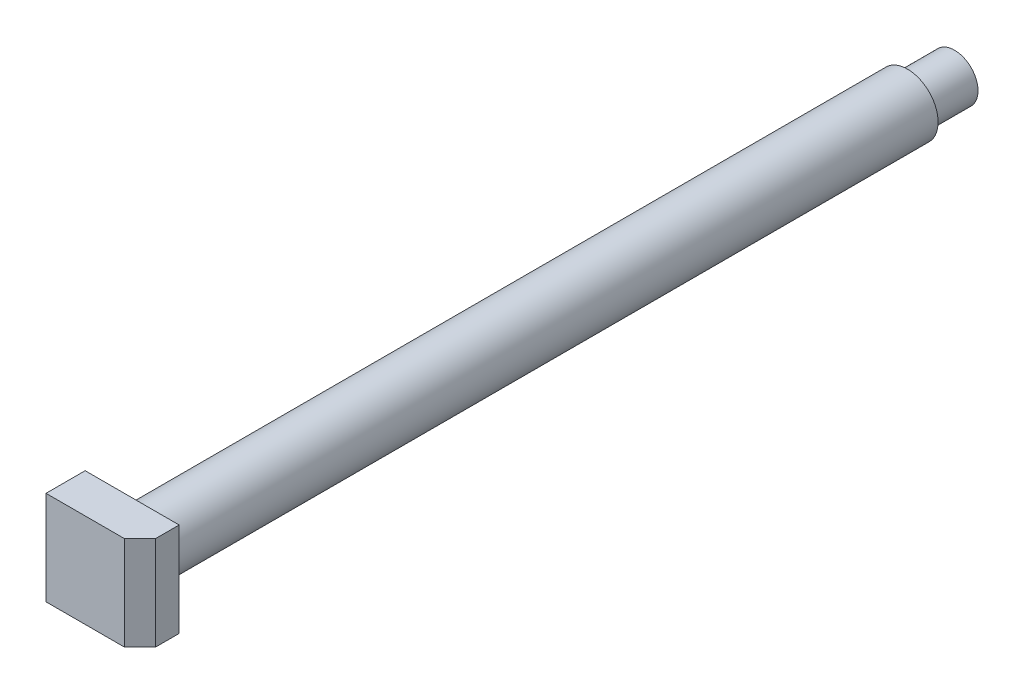
from build123d import *

# Parameters (mm, degrees)
ESQUISSE1_R                                   = 3.9
BOSS_EXTRU_1_DEPTH                            = 105
ESQUISSE2_W                                   = 12
ESQUISSE2_H                                   = 12
BOSS_EXTRU_2_DEPTH                            = 5
ESQUISSE14_R                                  = 3.9
ESQUISSE14_R_2                                = 3
ENL_V_MAT_EXTRU_1_DEPTH                       = 6
CHANFREIN1_SIZE                               = 2
TROU_POUR_TARAUDAGE_POUR_TROU_TARAUD_M3_D     = 2.5
TROU_POUR_TARAUDAGE_POUR_TROU_TARAUD_M3_DEPTH = 12


with BuildPart() as part:
    # Esquisse1 → Boss.-Extru.1 (new body)
    with BuildSketch(Plane.XY):
        with Locations((-68.275651986, -15.580620135)):
            Circle(ESQUISSE1_R)
    extrude(amount=BOSS_EXTRU_1_DEPTH)

    # Esquisse2 → Boss.-Extru.2 (add)
    with BuildSketch(Plane.XY.offset(105)):
        with Locations((-68.275651986, -15.580620135)):
            Rectangle(ESQUISSE2_W, ESQUISSE2_H)
    extrude(amount=BOSS_EXTRU_2_DEPTH)

    # Esquisse14 → Enlèv. mat.-Extru.1 (cut)
    with BuildSketch(Plane(origin=(0, 0, 0), x_dir=(-1, 0, 0), z_dir=(0, 0, -1))):
        with Locations((68.275651986, -15.580620135)):
            Circle(ESQUISSE14_R)
        with Locations((68.275651986, -15.580620135)):
            Circle(ESQUISSE14_R_2, mode=Mode.SUBTRACT)
    extrude(amount=-ENL_V_MAT_EXTRU_1_DEPTH, mode=Mode.SUBTRACT)

    # Chanfrein1
    chanfrein1_edges = [part.edges().sort_by_distance(p)[0] for p in [
        (-62.275651986, -15.580620135, 110),
    ]]
    chamfer(chanfrein1_edges, length=CHANFREIN1_SIZE)

    # Trou pour taraudage pour trou taraudé M3x0.51
    with Locations(Plane(origin=(0, 0, 0), x_dir=(-1, 0, 0), z_dir=(0, 0, -1))):
        with Locations((68.275651986, -15.580620135)):
            Hole(TROU_POUR_TARAUDAGE_POUR_TROU_TARAUD_M3_D / 2, depth=TROU_POUR_TARAUDAGE_POUR_TROU_TARAUD_M3_DEPTH)


solid = part.part
